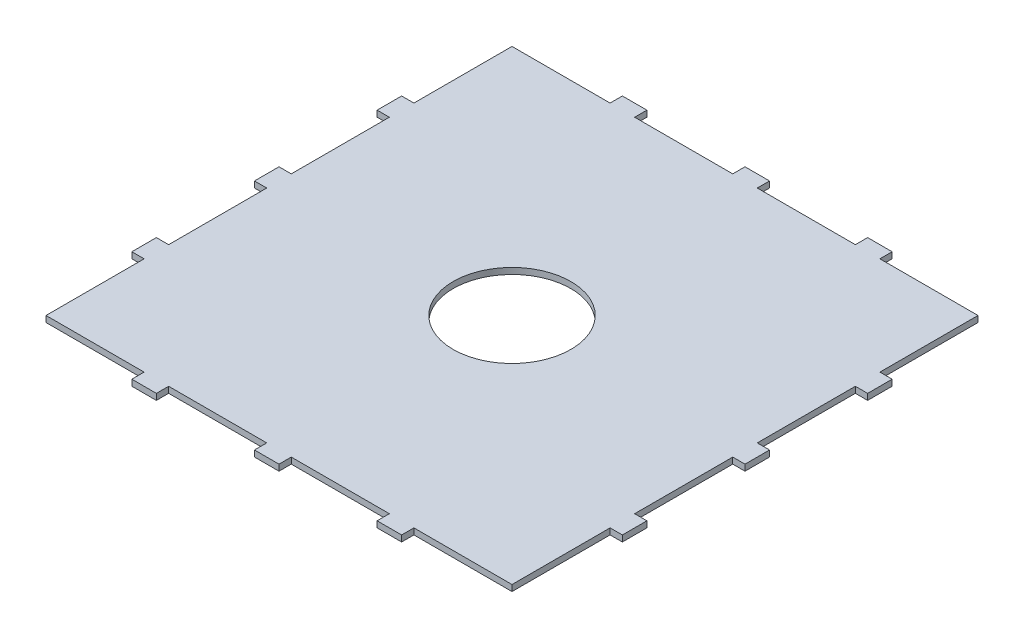
from build123d import *

# Parameters (mm, degrees)
SKETCH1_R           = 15.24
BOSS_EXTRUDE1_DEPTH = 1.5875


with BuildPart() as part:
    # Sketch1 → Boss-Extrude1 (new body)
    with BuildSketch(Plane(origin=(0, 0, 0), x_dir=(1, 0, 0), z_dir=(0, 1, 0))):
        Polygon((3.175, 63.5), (-3.175, 63.5), (-3.175, 60.325), (-28.575, 60.325), (-28.575, 63.5), (-34.925, 63.5), (-34.925, 60.325), (-60.325, 60.325), (-60.325, 34.925), (-63.5, 34.925), (-63.5, 28.575), (-60.325, 28.575), (-60.325, 3.175), (-63.5, 3.175), (-63.5, -3.175), (-60.325, -3.175), (-60.325, -28.575), (-63.5, -28.575), (-63.5, -34.925), (-60.325, -34.925), (-60.325, -60.325), (-34.925, -60.325), (-34.925, -63.5), (-28.575, -63.5), (-28.575, -60.325), (-3.175, -60.325), (-3.175, -63.5), (3.175, -63.5), (3.175, -60.325), (28.575, -60.325), (28.575, -63.5), (34.925, -63.5), (34.925, -60.325), (60.325, -60.325), (60.325, -34.925), (63.5, -34.925), (63.5, -28.575), (60.325, -28.575), (60.325, -3.175), (63.5, -3.175), (63.5, 3.175), (60.325, 3.175), (60.325, 28.575), (63.5, 28.575), (63.5, 34.925), (60.325, 34.925), (60.325, 60.325), (34.925, 60.325), (34.925, 63.5), (28.575, 63.5), (28.575, 60.325), (3.175, 60.325), align=None)
        with Locations(Location((0, 0, 0), (0, 0, 270))):
            Circle(SKETCH1_R, mode=Mode.SUBTRACT)
    extrude(amount=BOSS_EXTRUDE1_DEPTH)


solid = part.part
